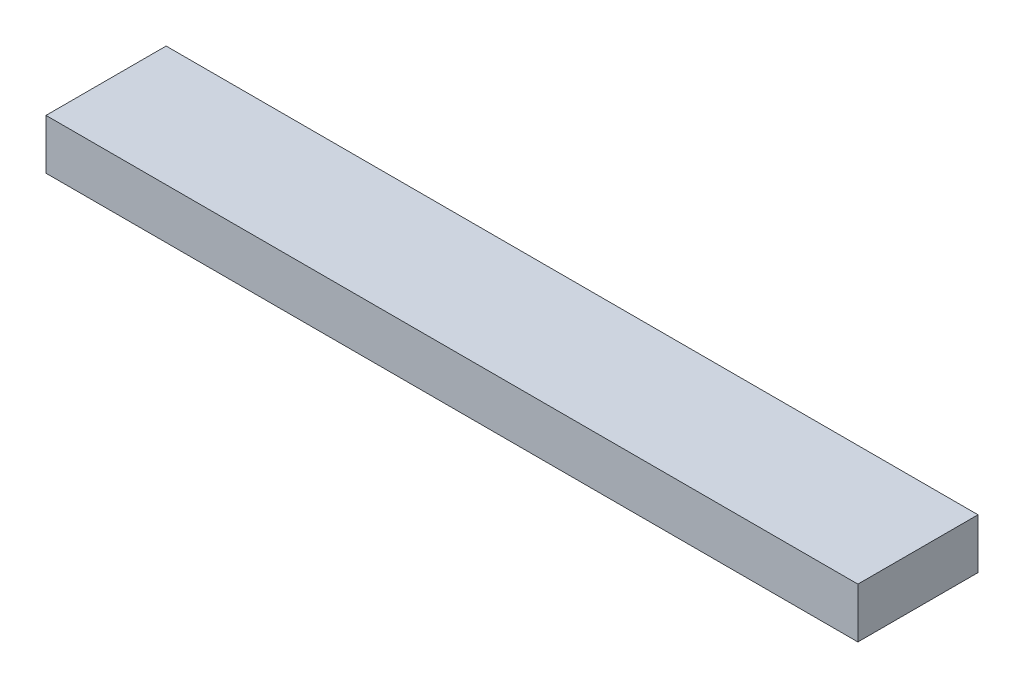
from build123d import *

# Parameters (mm, degrees)
SKETCH1_W           = 162
SKETCH1_H           = 23.969387756
BOSS_EXTRUDE1_DEPTH = 10


with BuildPart() as part:
    # Sketch1 → Boss-Extrude1 (new body)
    with BuildSketch(Plane(origin=(0, 0, 0), x_dir=(1, 0, 0), z_dir=(0, 1, 0))):
        Rectangle(SKETCH1_W, SKETCH1_H)
    extrude(amount=BOSS_EXTRUDE1_DEPTH)


solid = part.part
